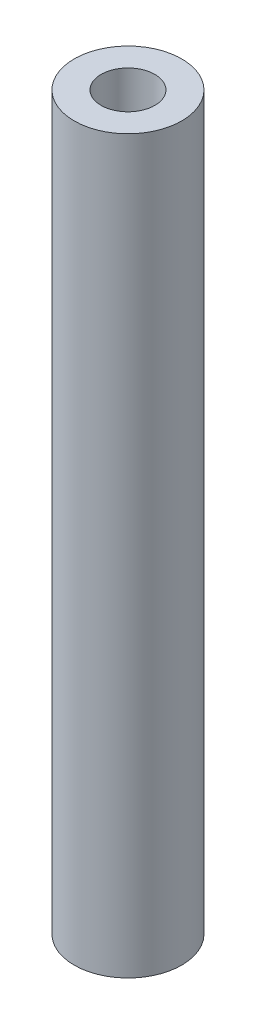
from build123d import *

# Parameters (mm, degrees)
SKETCH1_R                   = 2.5
BOSS_EXTRUDE1_DEPTH         = 34
TAP_DRILL_FOR_M3_TAP1_D     = 2.5
TAP_DRILL_FOR_M3_TAP1_DEPTH = 8
TAP_DRILL_FOR_M3_TAP1_TIP   = 0.751075774
TAP_DRILL_FOR_M3_TAP2_D     = 2.5
TAP_DRILL_FOR_M3_TAP2_DEPTH = 8
TAP_DRILL_FOR_M3_TAP2_TIP   = 0.751075774


with BuildPart() as part:
    # Sketch1 → Boss-Extrude1 (new body)
    with BuildSketch(Plane(origin=(0, 0, 0), x_dir=(1, 0, 0), z_dir=(0, 1, 0))):
        with Locations(Location((0, 0, 0), (0, 0, 270))):
            Circle(SKETCH1_R)
    extrude(amount=BOSS_EXTRUDE1_DEPTH)

    # Tap Drill for M3 Tap1
    with Locations(Plane(origin=(0, 34, 0), x_dir=(1, 0, 0), z_dir=(0, 1, 0))):
        with Locations((0, 0)):
            Hole(TAP_DRILL_FOR_M3_TAP1_D / 2, depth=TAP_DRILL_FOR_M3_TAP1_DEPTH)
            with Locations((0, 0, -(TAP_DRILL_FOR_M3_TAP1_DEPTH + TAP_DRILL_FOR_M3_TAP1_TIP / 2))):  # 118° drill point
                Cone(0, TAP_DRILL_FOR_M3_TAP1_D / 2, TAP_DRILL_FOR_M3_TAP1_TIP, mode=Mode.SUBTRACT)

    # Tap Drill for M3 Tap2
    with Locations(Plane(origin=(0, 0, 0), x_dir=(-1, 0, 0), z_dir=(0, -1, 0))):
        with Locations((0, 0)):
            Hole(TAP_DRILL_FOR_M3_TAP2_D / 2, depth=TAP_DRILL_FOR_M3_TAP2_DEPTH)
            with Locations((0, 0, -(TAP_DRILL_FOR_M3_TAP2_DEPTH + TAP_DRILL_FOR_M3_TAP2_TIP / 2))):  # 118° drill point
                Cone(0, TAP_DRILL_FOR_M3_TAP2_D / 2, TAP_DRILL_FOR_M3_TAP2_TIP, mode=Mode.SUBTRACT)


solid = part.part
